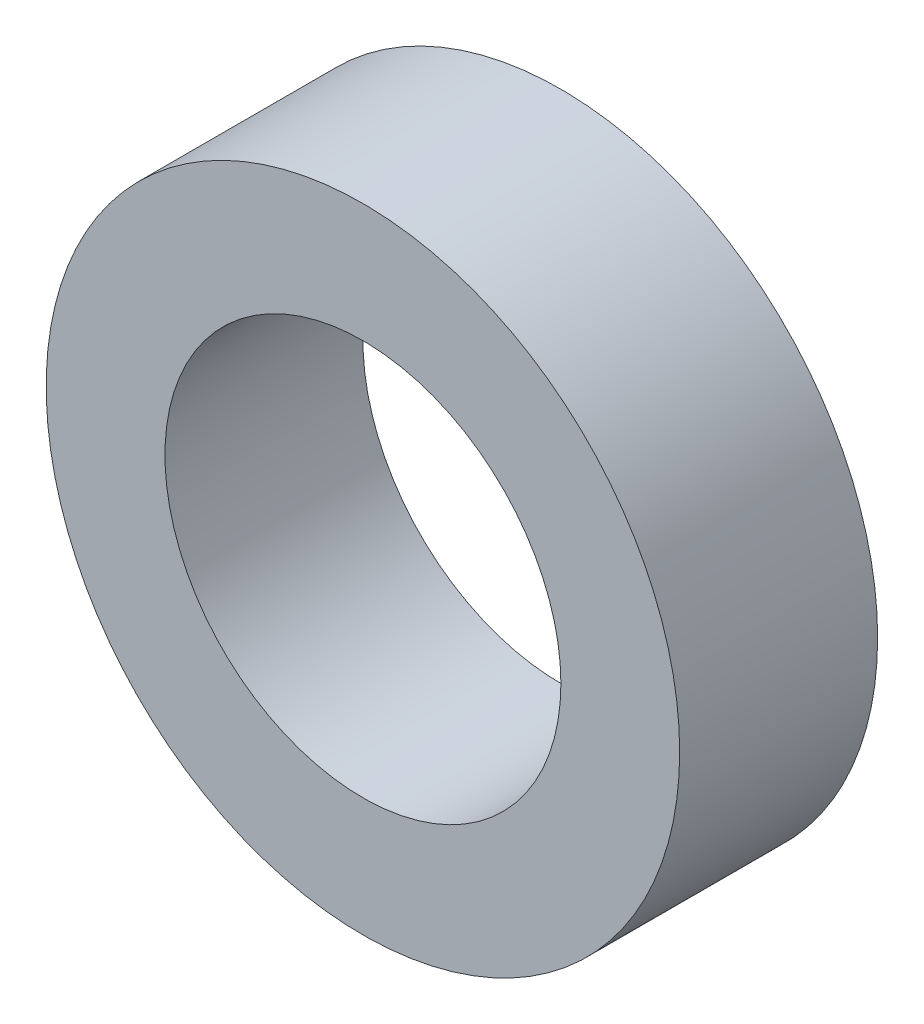
from build123d import *

# Parameters (mm, degrees)
ESQUISSE1_R        = 4
ESQUISSE1_R_2      = 2.5
BOSS_EXTRU_1_DEPTH = 2.5


with BuildPart() as part:
    # Esquisse1 → Boss.-Extru.1 (new body)
    with BuildSketch(Plane.XY):
        Circle(ESQUISSE1_R)
        Circle(ESQUISSE1_R_2, mode=Mode.SUBTRACT)
    extrude(amount=-BOSS_EXTRU_1_DEPTH)


solid = part.part
